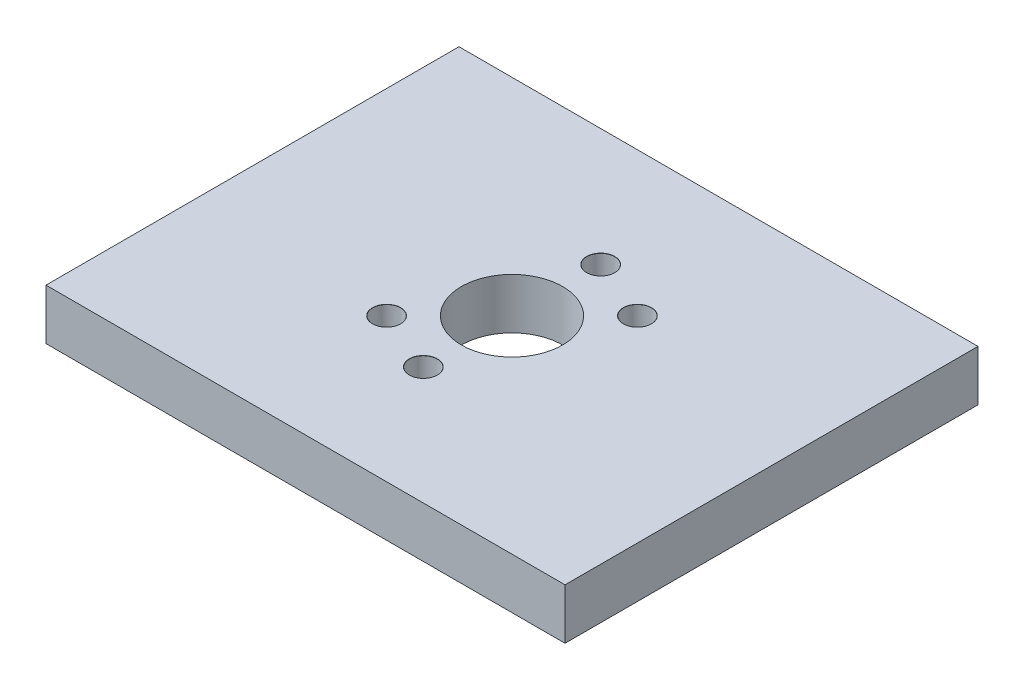
from build123d import *

# Parameters (mm, degrees)
SKETCH1_W                      = 102.443759186
SKETCH1_H                      = 81.508386056
BOSS_EXTRUDE1_DEPTH            = 10
M5_CLEARANCE_HOLE1_D           = 5.5
M5_CLEARANCE_HOLE1_CSINK_D     = 5.55
M5_CLEARANCE_HOLE1_CSINK_ANGLE = 90
SKETCH5_R                      = 10
CUT_EXTRUDE1_DEPTH             = 67.216200422


with BuildPart() as part:
    # Sketch1 → Boss-Extrude1 (new body)
    with BuildSketch(Plane(origin=(0, 0, 0), x_dir=(1, 0, 0), z_dir=(0, 1, 0))):
        Rectangle(SKETCH1_W, SKETCH1_H)
    extrude(amount=BOSS_EXTRUDE1_DEPTH)

    # M5 Clearance Hole1 (through all)
    with Locations(Plane(origin=(0, 10, 0), x_dir=(1, 0, 0), z_dir=(0, 1, 0))):
        with Locations((-12.374368671, -12.374368671), (0, -17.5), (12.374368671, 12.374368671), (0, 17.5)):
            CounterSinkHole(M5_CLEARANCE_HOLE1_D / 2, M5_CLEARANCE_HOLE1_CSINK_D / 2, counter_sink_angle=M5_CLEARANCE_HOLE1_CSINK_ANGLE)

    # Sketch5 → Cut-Extrude1 (cut, through all)
    with BuildSketch(Plane(origin=(0, 10, 0), x_dir=(1, 0, 0), z_dir=(0, 1, 0))):
        with Locations(Location((0, 0, 0), (0, 0, 270))):
            Circle(SKETCH5_R)
    extrude(amount=-CUT_EXTRUDE1_DEPTH, mode=Mode.SUBTRACT)


solid = part.part
